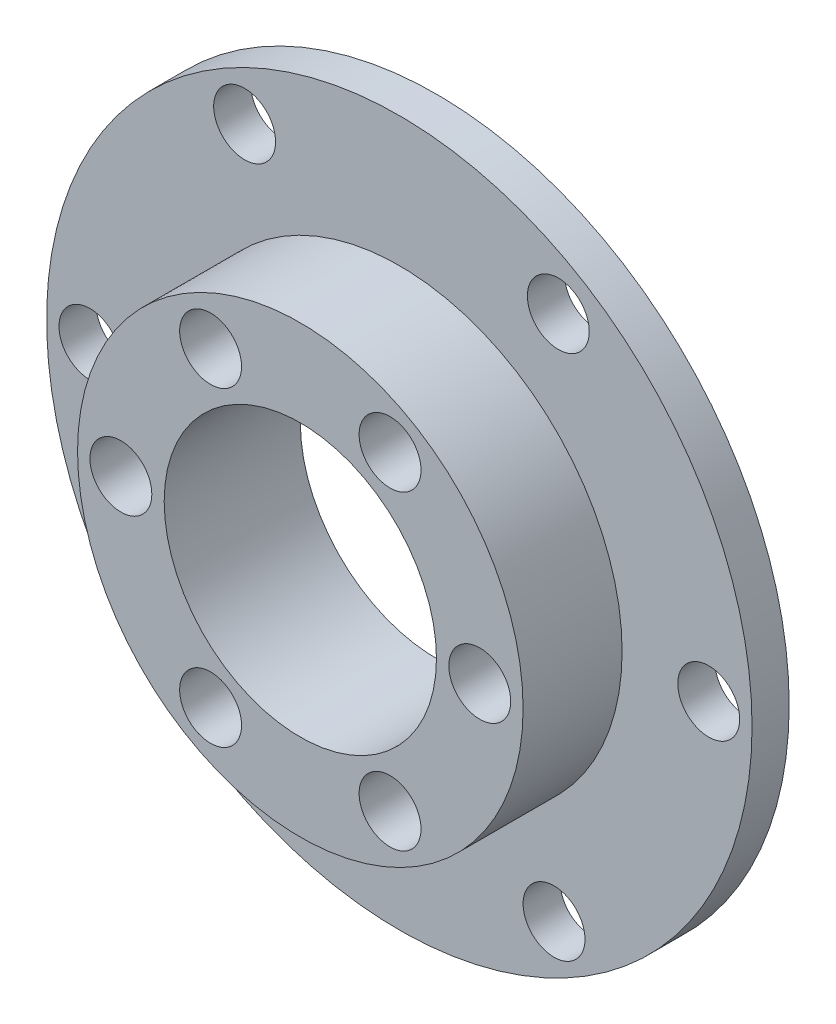
from build123d import *

# Parameters (mm, degrees)
SKETCH_1_R      = 28.5
SKETCH_1_R_2    = 2.5
SKETCH_1_R_3    = 18
SKETCH_1_R_4    = 11
EXTRUDE_3_DEPTH = 3
SKETCH_3_R      = 18
SKETCH_3_R_2    = 11
SKETCH_3_R_3    = 2.5
EXTRUDE_4_DEPTH = 8


with BuildPart() as part:
    # 草图1 → 凸台-拉伸3 (new body)
    # profile 1 of 2: a face of its own
    with BuildSketch(Plane.XY):
        Circle(SKETCH_1_R)
        with Locations((-12.5, -21.650635095)):
            Circle(SKETCH_1_R_2, mode=Mode.SUBTRACT)
        with Locations((12.5, -21.650635095)):
            Circle(SKETCH_1_R_2, mode=Mode.SUBTRACT)
        with Locations((25, 0)):
            Circle(SKETCH_1_R_2, mode=Mode.SUBTRACT)
        with Locations((12.846045577, 21.051266574)):
            Circle(SKETCH_1_R_2, mode=Mode.SUBTRACT)
        with Locations((-25, 0)):
            Circle(SKETCH_1_R_2, mode=Mode.SUBTRACT)
        with Locations((-12.5, 21.650635095)):
            Circle(SKETCH_1_R_2, mode=Mode.SUBTRACT)
        Circle(SKETCH_1_R_3, mode=Mode.SUBTRACT)
    # profile 2 of 2: a face of its own
    with BuildSketch(Plane.XY):
        Circle(SKETCH_1_R_3)
        Circle(SKETCH_1_R_4, mode=Mode.SUBTRACT)
        with Locations((-7.25, 12.557368355)):
            Circle(SKETCH_1_R_2, mode=Mode.SUBTRACT)
        with Locations((7.25, 12.557368355)):
            Circle(SKETCH_1_R_2, mode=Mode.SUBTRACT)
        with Locations((-14.5, 0)):
            Circle(SKETCH_1_R_2, mode=Mode.SUBTRACT)
        with Locations((14.5, 0)):
            Circle(SKETCH_1_R_2, mode=Mode.SUBTRACT)
        with Locations((7.25, -12.557368355)):
            Circle(SKETCH_1_R_2, mode=Mode.SUBTRACT)
        with Locations((-7.25, -12.557368355)):
            Circle(SKETCH_1_R_2, mode=Mode.SUBTRACT)
    extrude(amount=EXTRUDE_3_DEPTH)

    # 草图3 → 凸台-拉伸4 (add)
    with BuildSketch(Plane.XY.offset(3)):
        Circle(SKETCH_3_R)
        Circle(SKETCH_3_R_2, mode=Mode.SUBTRACT)
        with Locations((-14.5, 0)):
            Circle(SKETCH_3_R_3, mode=Mode.SUBTRACT)
        with Locations((-7.25, 12.557368355)):
            Circle(SKETCH_3_R_3, mode=Mode.SUBTRACT)
        with Locations((7.25, 12.557368355)):
            Circle(SKETCH_3_R_3, mode=Mode.SUBTRACT)
        with Locations((14.5, 0)):
            Circle(SKETCH_3_R_3, mode=Mode.SUBTRACT)
        with Locations((7.25, -12.557368355)):
            Circle(SKETCH_3_R_3, mode=Mode.SUBTRACT)
        with Locations((-7.25, -12.557368355)):
            Circle(SKETCH_3_R_3, mode=Mode.SUBTRACT)
    extrude(amount=EXTRUDE_4_DEPTH)


solid = part.part
